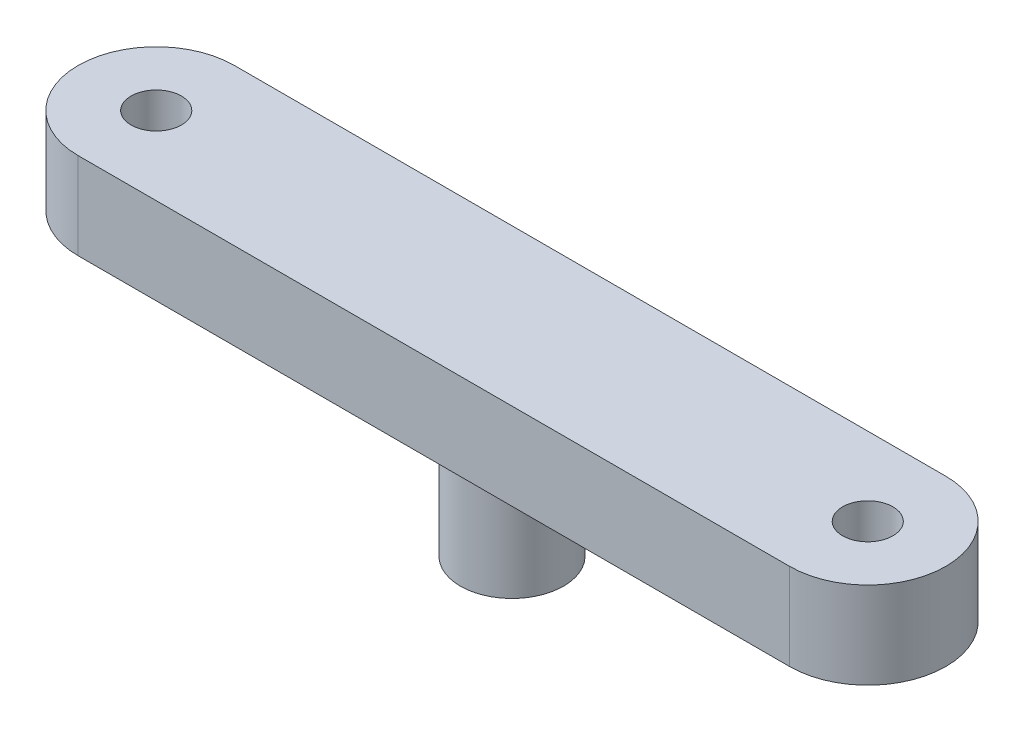
from build123d import *

# Parameters (mm, degrees)
BARRA_START         = -32.5
SK_BARRA_W          = 41
SK_BARRA_H          = 9
BARRA_DEPTH         = 5
EXTREMOS_START      = -32.5
SK_EXTREMOS_R       = 4.5
EXTREMOS_DEPTH      = 5
PERNO_696_START     = -39.5
SK_PERNO_696_R      = 2.975
PERNO_696_DEPTH     = 7
PASANTES_M2_5_START = -32.5
SK_PASANTES_M2_5_R  = 1.45
PASANTES_M2_5_DEPTH = 5
CAJAS_M2_5_START    = -32.5
SK_CAJAS_M2_5_R     = 2.5
CAJAS_M2_5_DEPTH    = 2.7


with BuildPart() as part:
    # Sk_Barra → Barra (new body)
    with BuildSketch(Plane(origin=(0, 0, 0), x_dir=(1, 0, 0), z_dir=(0, 1, 0)).offset(BARRA_START)):
        with Locations((0, -490)):
            Rectangle(SK_BARRA_W, SK_BARRA_H)
    extrude(amount=BARRA_DEPTH)

    # Sk_Extremos → Extremos (add)
    with BuildSketch(Plane(origin=(0, 0, 0), x_dir=(1, 0, 0), z_dir=(0, 1, 0)).offset(EXTREMOS_START)):
        with Locations((-20.5, -490)):
            Circle(SK_EXTREMOS_R)
        with Locations((20.5, -490)):
            Circle(SK_EXTREMOS_R)
    extrude(amount=EXTREMOS_DEPTH)

    # Sk_Perno_696 → Perno_696 (add)
    with BuildSketch(Plane(origin=(0, 0, 0), x_dir=(1, 0, 0), z_dir=(0, 1, 0)).offset(PERNO_696_START)):
        with Locations(Location((0, -490, 0), (0, 0, 270))):
            Circle(SK_PERNO_696_R)
    extrude(amount=PERNO_696_DEPTH)

    # Sk_Pasantes_M2-5 → Pasantes_M2-5 (cut)
    with BuildSketch(Plane(origin=(0, 0, 0), x_dir=(1, 0, 0), z_dir=(0, 1, 0)).offset(PASANTES_M2_5_START)):
        with Locations(Location((-20.5, -490, 0), (0, 0, 270))):
            Circle(SK_PASANTES_M2_5_R)
        with Locations(Location((20.5, -490, 0), (0, 0, 270))):
            Circle(SK_PASANTES_M2_5_R)
    extrude(amount=PASANTES_M2_5_DEPTH, mode=Mode.SUBTRACT)

    # Sk_Cajas_M2-5 → Cajas_M2-5 (cut)
    with BuildSketch(Plane(origin=(0, 0, 0), x_dir=(1, 0, 0), z_dir=(0, 1, 0)).offset(CAJAS_M2_5_START)):
        with Locations(Location((-20.5, -490, 0), (0, 0, 270))):
            Circle(SK_CAJAS_M2_5_R)
        with Locations(Location((20.5, -490, 0), (0, 0, 270))):
            Circle(SK_CAJAS_M2_5_R)
    extrude(amount=CAJAS_M2_5_DEPTH, mode=Mode.SUBTRACT)


solid = part.part
